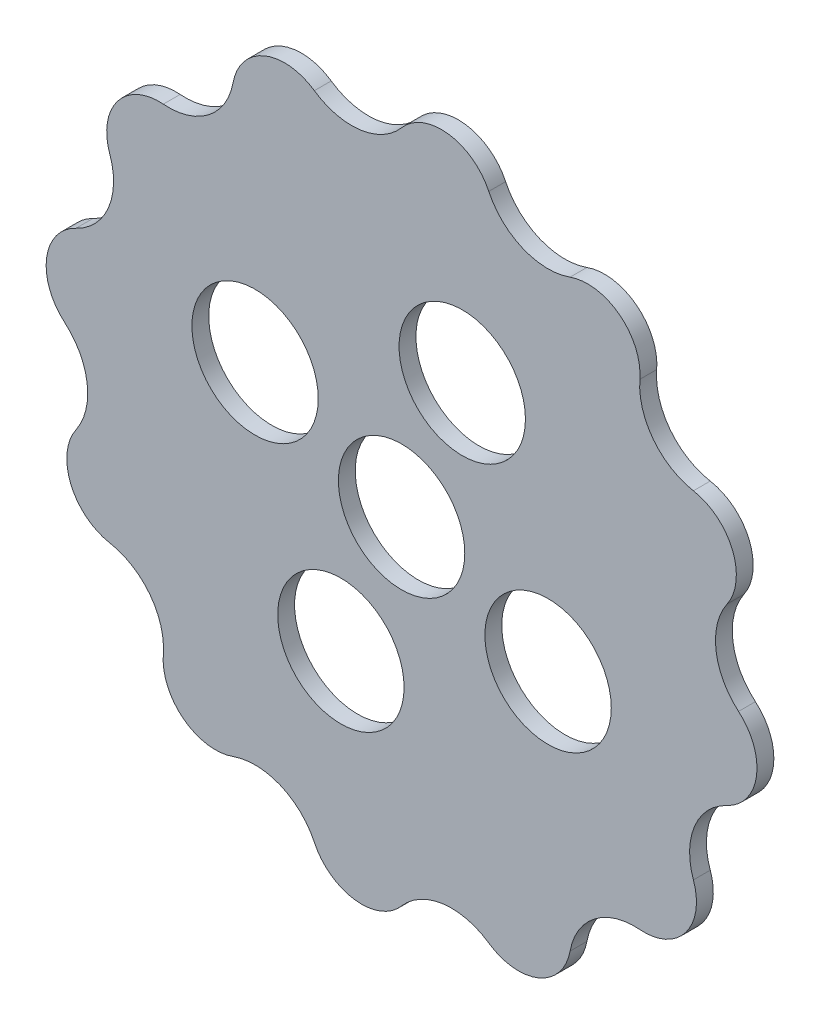
from build123d import *

# Parameters (mm, degrees)
CROQUIS3_R              = 85
SALIENTE_EXTRUIR1_DEPTH = 4
CORTAR_EXTRUIR1_START   = -4
CORTAR_EXTRUIR1_DEPTH   = 4
CROQUIS5_R              = 15
CORTAR_EXTRUIR2_DEPTH   = 4
CROQUIS6_R              = 15
CORTAR_EXTRUIR3_DEPTH   = 4


with BuildPart() as part:
    # Croquis3 → Saliente-Extruir1 (new body)
    with BuildSketch(Plane.XY):
        Circle(CROQUIS3_R)
    extrude(amount=SALIENTE_EXTRUIR1_DEPTH)

    # Croquis4 → Cortar-Extruir1 (cut)
    with BuildSketch(Plane.XY.offset(4).offset(CORTAR_EXTRUIR1_START)):
        with BuildLine():
            ThreePointArc((51.744720944, 67.435034325), (32.528091082, 78.52976054), (11.094725556, 84.27281332))
            ThreePointArc((11.094725556, 84.27281332), (16.790892389, 81.996657131), (20.705523608, 77.274066103))
            ThreePointArc((20.705523608, 77.274066103), (28.813811378, 69.562694213), (40, 69.282032303))
            ThreePointArc((40, 69.282032303), (46.107437706, 69.853346275), (51.744720944, 67.435034325))
        make_face()
        with BuildLine():
            ThreePointArc((-20.705523608, 77.274066103), (-10.442095378, 79.31558891), (0, 80))
            ThreePointArc((0, 80), (5.003539158, 83.548491243), (11.094725556, 84.27281332))
            ThreePointArc((11.094725556, 84.27281332), (-11.094726837, 84.272813151), (-32.52809195, 78.529760181))
            ThreePointArc((-32.52809195, 78.529760181), (-26.456988918, 79.406634265), (-20.705523608, 77.274066103))
        make_face()
        with BuildLine():
            ThreePointArc((-20.705523608, 77.274066103), (-9.827854473, 74.649966033), (0, 80))
            ThreePointArc((0, 80), (-10.442095378, 79.31558891), (-20.705523608, 77.274066103))
        make_face()
        with BuildLine():
            ThreePointArc((-40, 69.282032303), (-37.441053421, 74.856885666), (-32.52809195, 78.529760181))
            ThreePointArc((-32.52809195, 78.529760181), (-51.744721795, 67.435033672), (-67.435034299, 51.744720978))
            ThreePointArc((-67.435034299, 51.744720978), (-62.615741826, 55.539667962), (-56.568542495, 56.568542495))
            ThreePointArc((-56.568542495, 56.568542495), (-48.700914321, 63.468267223), (-40, 69.282032303))
        make_face()
        with BuildLine():
            ThreePointArc((-56.568542495, 56.568542495), (-45.836154655, 59.73483974), (-40, 69.282032303))
            ThreePointArc((-40, 69.282032303), (-48.700914321, 63.468267223), (-56.568542495, 56.568542495))
        make_face()
        with BuildLine():
            ThreePointArc((-69.282032303, 40), (-69.853346272, 46.107437728), (-67.435034299, 51.744720978))
            ThreePointArc((-67.435034299, 51.744720978), (-78.529760525, 32.528091121), (-84.272813315, 11.094725594))
            ThreePointArc((-84.272813315, 11.094725594), (-81.996657119, 16.790892405), (-77.274066103, 20.705523608))
            ThreePointArc((-77.274066103, 20.705523608), (-73.910362601, 30.614674589), (-69.282032303, 40))
        make_face()
        with BuildLine():
            ThreePointArc((-77.274066103, 20.705523608), (-69.562694213, 28.813811378), (-69.282032303, 40))
            ThreePointArc((-69.282032303, 40), (-73.910362601, 30.614674589), (-77.274066103, 20.705523608))
        make_face()
        with BuildLine():
            ThreePointArc((-80, 0), (-83.54849125, 5.003539176), (-84.272813315, 11.094725594))
            ThreePointArc((-84.272813315, 11.094725594), (-84.272813233, -11.094726218), (-78.529760644, -32.528090833))
            ThreePointArc((-78.529760644, -32.528090833), (-79.406634201, -26.456988317), (-77.274066103, -20.705523608))
            ThreePointArc((-77.274066103, -20.705523608), (-79.31558891, -10.442095378), (-80, 0))
        make_face()
        with BuildLine():
            ThreePointArc((-77.274066103, -20.705523608), (-74.649966033, -9.827854473), (-80, 0))
            ThreePointArc((-80, 0), (-79.31558891, -10.442095378), (-77.274066103, -20.705523608))
        make_face()
        with BuildLine():
            ThreePointArc((-69.282032303, -40), (-74.856886137, -37.441053042), (-78.529760644, -32.528090833))
            ThreePointArc((-78.529760644, -32.528090833), (-67.435033831, -51.744721588), (-51.744720432, -67.435034718))
            ThreePointArc((-51.744720432, -67.435034718), (-55.539667823, -62.61574214), (-56.568542495, -56.568542495))
            ThreePointArc((-56.568542495, -56.568542495), (-63.468267223, -48.700914321), (-69.282032303, -40))
        make_face()
        with BuildLine():
            ThreePointArc((-56.568542495, -56.568542495), (-59.73483974, -45.836154655), (-69.282032303, -40))
            ThreePointArc((-69.282032303, -40), (-63.468267223, -48.700914321), (-56.568542495, -56.568542495))
        make_face()
        with BuildLine():
            ThreePointArc((-40, -69.282032303), (-46.107437388, -69.853346325), (-51.744720432, -67.435034718))
            ThreePointArc((-51.744720432, -67.435034718), (-32.528090639, -78.529760724), (-11.094725244, -84.272813361))
            ThreePointArc((-11.094725244, -84.272813361), (-16.790892262, -81.996657223), (-20.705523608, -77.274066103))
            ThreePointArc((-20.705523608, -77.274066103), (-30.614674589, -73.910362601), (-40, -69.282032303))
        make_face()
        with BuildLine():
            ThreePointArc((-20.705523608, -77.274066103), (-28.813811378, -69.562694213), (-40, -69.282032303))
            ThreePointArc((-40, -69.282032303), (-30.614674589, -73.910362601), (-20.705523608, -77.274066103))
        make_face()
        with BuildLine():
            ThreePointArc((-11.094725244, -84.272813361), (11.09472631, -84.272813221), (32.528090677, -78.529760708))
            ThreePointArc((32.528090677, -78.529760708), (26.456988234, -79.406634192), (20.705523608, -77.274066103))
            ThreePointArc((20.705523608, -77.274066103), (10.442095378, -79.31558891), (0, -80))
            ThreePointArc((0, -80), (-5.003539011, -83.548491186), (-11.094725244, -84.272813361))
        make_face()
        with BuildLine():
            ThreePointArc((0, -80), (10.442095378, -79.31558891), (20.705523608, -77.274066103))
            ThreePointArc((20.705523608, -77.274066103), (9.827854473, -74.649966033), (0, -80))
        make_face()
        with BuildLine():
            ThreePointArc((40, -69.282032303), (48.700914321, -63.468267223), (56.568542495, -56.568542495))
            ThreePointArc((56.568542495, -56.568542495), (45.836154655, -59.73483974), (40, -69.282032303))
        make_face()
        with BuildLine():
            ThreePointArc((32.528090677, -78.529760708), (51.74472148, -67.435033914), (67.435034654, -51.744720516))
            ThreePointArc((67.435034654, -51.744720516), (62.615742092, -55.539667844), (56.568542495, -56.568542495))
            ThreePointArc((56.568542495, -56.568542495), (48.700914321, -63.468267223), (40, -69.282032303))
            ThreePointArc((40, -69.282032303), (37.441052989, -74.856886202), (32.528090677, -78.529760708))
        make_face()
        with BuildLine():
            ThreePointArc((67.435034654, -51.744720516), (78.529760638, -32.528090847), (84.272813316, -11.094725585))
            ThreePointArc((84.272813316, -11.094725585), (81.996657122, -16.790892401), (77.274066103, -20.705523608))
            ThreePointArc((77.274066103, -20.705523608), (73.910362601, -30.614674589), (69.282032303, -40))
            ThreePointArc((69.282032303, -40), (69.853346317, -46.10743744), (67.435034654, -51.744720516))
        make_face()
        with BuildLine():
            ThreePointArc((69.282032303, -40), (73.910362601, -30.614674589), (77.274066103, -20.705523608))
            ThreePointArc((77.274066103, -20.705523608), (69.562694213, -28.813811378), (69.282032303, -40))
        make_face()
        with BuildLine():
            ThreePointArc((85, 0), (83.36674891, 16.582676993), (78.529760559, 32.528091037))
            ThreePointArc((78.529760559, 32.528091037), (79.406634213, 26.456988427), (77.274066103, 20.705523608))
            ThreePointArc((77.274066103, 20.705523608), (79.31558891, 10.442095378), (80, 0))
            ThreePointArc((80, 0), (83.548491248, -5.003539172), (84.272813316, -11.094725585))
            ThreePointArc((84.272813316, -11.094725585), (84.8180085, -5.559265605), (85, 0))
        make_face()
        with BuildLine():
            ThreePointArc((80, 0), (79.31558891, 10.442095378), (77.274066103, 20.705523608))
            ThreePointArc((77.274066103, 20.705523608), (74.649966033, 9.827854473), (80, 0))
        make_face()
        with BuildLine():
            ThreePointArc((78.529760559, 32.528091037), (67.43503396, 51.74472142), (51.744720944, 67.435034325))
            ThreePointArc((51.744720944, 67.435034325), (55.539667954, 62.615741846), (56.568542495, 56.568542495))
            ThreePointArc((56.568542495, 56.568542495), (63.468267223, 48.700914321), (69.282032303, 40))
            ThreePointArc((69.282032303, 40), (74.856886051, 37.441053111), (78.529760559, 32.528091037))
        make_face()
        with BuildLine():
            ThreePointArc((69.282032303, 40), (63.468267223, 48.700914321), (56.568542495, 56.568542495))
            ThreePointArc((56.568542495, 56.568542495), (59.73483974, 45.836154655), (69.282032303, 40))
        make_face()
    extrude(amount=CORTAR_EXTRUIR1_DEPTH, mode=Mode.SUBTRACT)

    # Croquis5 → Cortar-Extruir2 (cut)
    with BuildSketch(Plane.XY.offset(4)):
        Circle(CROQUIS5_R)
    extrude(amount=-CORTAR_EXTRUIR2_DEPTH, mode=Mode.SUBTRACT)

    # Croquis6 → Cortar-Extruir3 (cut)
    with BuildSketch(Plane.XY.offset(4)):
        with Locations((14.406905689, 34.781347106)):
            Circle(CROQUIS6_R)
        with Locations((34.781347106, -14.406905689)):
            Circle(CROQUIS6_R)
        with Locations((-14.406905689, -34.781347106)):
            Circle(CROQUIS6_R)
        with Locations((-34.781347106, 14.406905689)):
            Circle(CROQUIS6_R)
    extrude(amount=-CORTAR_EXTRUIR3_DEPTH, mode=Mode.SUBTRACT)


solid = part.part
